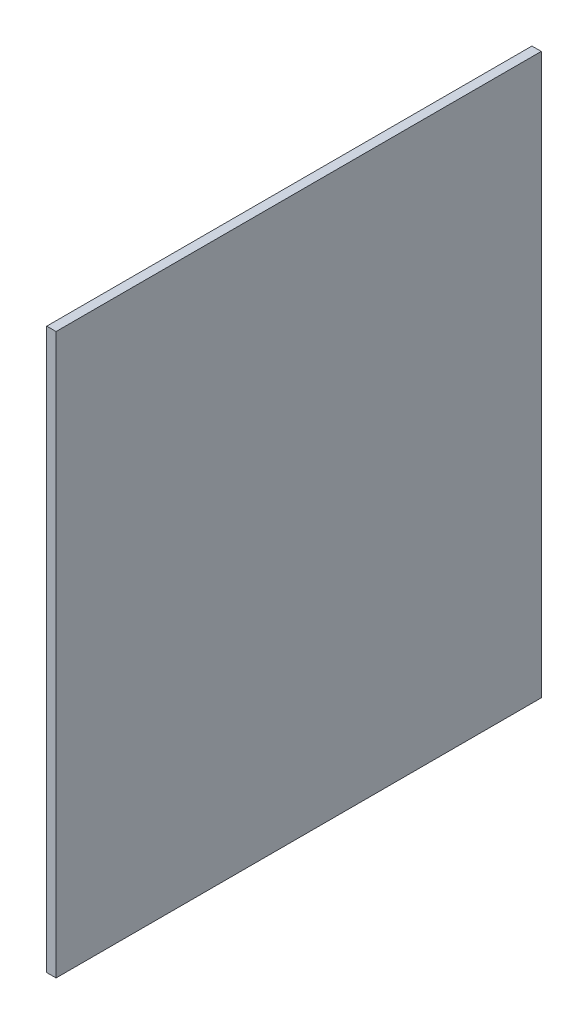
from build123d import *

# Parameters (mm, degrees)
SKETCH1_W           = 5
SKETCH1_H           = 300
BOSS_EXTRUDE1_DEPTH = 260


with BuildPart() as part:
    # Sketch1 → Boss-Extrude1 (new body)
    with BuildSketch(Plane.XY):
        with Locations((2.5, 150)):
            Rectangle(SKETCH1_W, SKETCH1_H)
    extrude(amount=BOSS_EXTRUDE1_DEPTH)


solid = part.part
